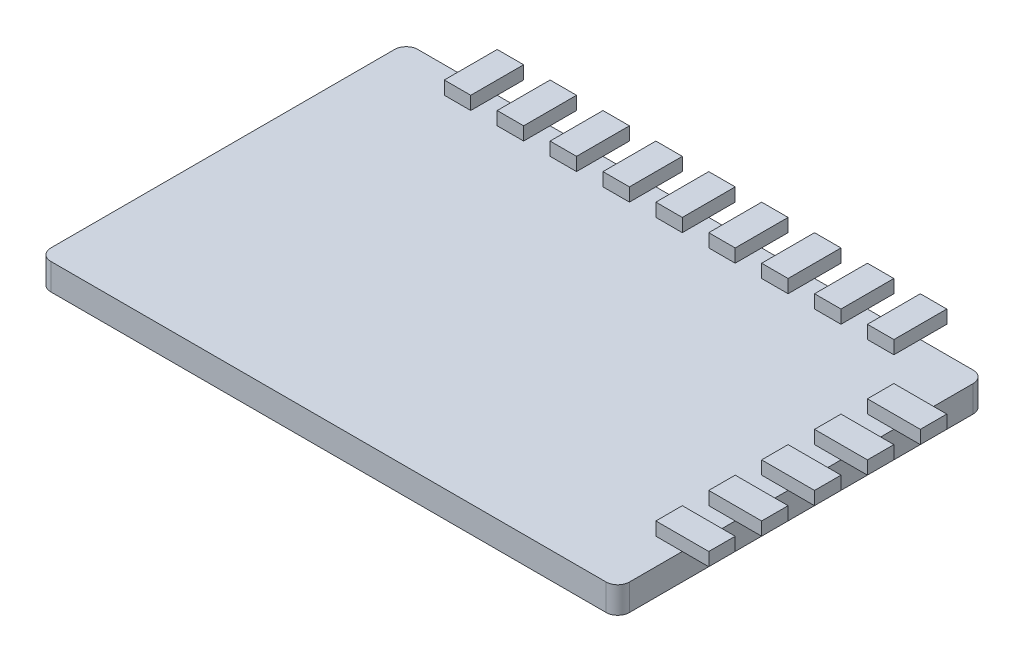
from build123d import *

# Parameters (mm, degrees)
BOSS_EXTRUDE1_DEPTH    = 6.35
SKETCH2_W              = 6.35
SKETCH2_H              = 12.7
BOSS_EXTRUDE2_DEPTH    = 3.175
BOSS_EXTRUDE2_2_DEPTH  = 3.175
BOSS_EXTRUDE2_3_DEPTH  = 3.175
BOSS_EXTRUDE2_4_DEPTH  = 3.175
BOSS_EXTRUDE2_5_DEPTH  = 3.175
BOSS_EXTRUDE2_6_DEPTH  = 3.175
BOSS_EXTRUDE2_7_DEPTH  = 3.175
BOSS_EXTRUDE2_8_DEPTH  = 3.175
BOSS_EXTRUDE2_9_DEPTH  = 3.175
SKETCH2_W_2            = 12.7
SKETCH2_H_2            = 6.35
BOSS_EXTRUDE2_10_DEPTH = 3.175
BOSS_EXTRUDE2_11_DEPTH = 3.175
BOSS_EXTRUDE2_12_DEPTH = 3.175
BOSS_EXTRUDE2_13_DEPTH = 3.175
BOSS_EXTRUDE2_14_DEPTH = 3.175


with BuildPart() as part:
    # Sketch1 → Boss-Extrude1 (new body)
    with BuildSketch(Plane(origin=(0, 0, 0), x_dir=(-1, 0, 0), z_dir=(0, 1, 0))):
        with BuildLine():
            Line((145.669, -92.075), (145.669, -9.525))
            ThreePointArc((145.669, -9.525), (144.850656347, -7.549343653), (142.875, -6.731))
            Line((142.875, -6.731), (9.525, -6.731))
            ThreePointArc((9.525, -6.731), (7.549343653, -7.549343653), (6.731, -9.525))
            Line((6.731, -9.525), (6.731, -92.075))
            ThreePointArc((6.731, -92.075), (7.549343653, -94.050656347), (9.525, -94.869))
            Line((9.525, -94.869), (142.875, -94.869))
            ThreePointArc((142.875, -94.869), (144.850656347, -94.050656347), (145.669, -92.075))
        make_face()
    extrude(amount=BOSS_EXTRUDE1_DEPTH)


with BuildPart() as body_2:
    # Sketch2 → Boss-Extrude2 (new body)
    with BuildSketch(Plane(origin=(0, 6.35, 0), x_dir=(1, 0, 0), z_dir=(0, 1, 0))):
        with Locations((-63.5, 94.869)):
            Rectangle(SKETCH2_W, SKETCH2_H)
    extrude(amount=BOSS_EXTRUDE2_DEPTH)


with BuildPart() as body_3:
    # Sketch2 → Boss-Extrude2 2 (new body)
    with BuildSketch(Plane(origin=(0, 6.35, 0), x_dir=(1, 0, 0), z_dir=(0, 1, 0))):
        with Locations((-76.2, 94.869)):
            Rectangle(SKETCH2_W, SKETCH2_H)
    extrude(amount=BOSS_EXTRUDE2_2_DEPTH)


with BuildPart() as body_4:
    # Sketch2 → Boss-Extrude2 3 (new body)
    with BuildSketch(Plane(origin=(0, 6.35, 0), x_dir=(1, 0, 0), z_dir=(0, 1, 0))):
        with Locations((-50.8, 94.869)):
            Rectangle(SKETCH2_W, SKETCH2_H)
    extrude(amount=BOSS_EXTRUDE2_3_DEPTH)


with BuildPart() as body_5:
    # Sketch2 → Boss-Extrude2 4 (new body)
    with BuildSketch(Plane(origin=(0, 6.35, 0), x_dir=(1, 0, 0), z_dir=(0, 1, 0))):
        with Locations((-38.1, 94.869)):
            Rectangle(SKETCH2_W, SKETCH2_H)
    extrude(amount=BOSS_EXTRUDE2_4_DEPTH)


with BuildPart() as body_6:
    # Sketch2 → Boss-Extrude2 5 (new body)
    with BuildSketch(Plane(origin=(0, 6.35, 0), x_dir=(1, 0, 0), z_dir=(0, 1, 0))):
        with Locations((-25.4, 94.869)):
            Rectangle(SKETCH2_W, SKETCH2_H)
    extrude(amount=BOSS_EXTRUDE2_5_DEPTH)


with BuildPart() as body_7:
    # Sketch2 → Boss-Extrude2 6 (new body)
    with BuildSketch(Plane(origin=(0, 6.35, 0), x_dir=(1, 0, 0), z_dir=(0, 1, 0))):
        with Locations((-88.9, 94.869)):
            Rectangle(SKETCH2_W, SKETCH2_H)
    extrude(amount=BOSS_EXTRUDE2_6_DEPTH)


with BuildPart() as body_8:
    # Sketch2 → Boss-Extrude2 7 (new body)
    with BuildSketch(Plane(origin=(0, 6.35, 0), x_dir=(1, 0, 0), z_dir=(0, 1, 0))):
        with Locations((-101.6, 94.869)):
            Rectangle(SKETCH2_W, SKETCH2_H)
    extrude(amount=BOSS_EXTRUDE2_7_DEPTH)


with BuildPart() as body_9:
    # Sketch2 → Boss-Extrude2 8 (new body)
    with BuildSketch(Plane(origin=(0, 6.35, 0), x_dir=(1, 0, 0), z_dir=(0, 1, 0))):
        with Locations((-114.3, 94.869)):
            Rectangle(SKETCH2_W, SKETCH2_H)
    extrude(amount=BOSS_EXTRUDE2_8_DEPTH)


with BuildPart() as body_10:
    # Sketch2 → Boss-Extrude2 9 (new body)
    with BuildSketch(Plane(origin=(0, 6.35, 0), x_dir=(1, 0, 0), z_dir=(0, 1, 0))):
        with Locations((-127, 94.869)):
            Rectangle(SKETCH2_W, SKETCH2_H)
    extrude(amount=BOSS_EXTRUDE2_9_DEPTH)


with BuildPart() as body_11:
    # Sketch2 → Boss-Extrude2 10 (new body)
    with BuildSketch(Plane(origin=(0, 6.35, 0), x_dir=(1, 0, 0), z_dir=(0, 1, 0))):
        with Locations((-6.731, 50.8)):
            Rectangle(SKETCH2_W_2, SKETCH2_H_2)
    extrude(amount=BOSS_EXTRUDE2_10_DEPTH)


with BuildPart() as body_12:
    # Sketch2 → Boss-Extrude2 11 (new body)
    with BuildSketch(Plane(origin=(0, 6.35, 0), x_dir=(1, 0, 0), z_dir=(0, 1, 0))):
        with Locations((-6.731, 63.5)):
            Rectangle(SKETCH2_W_2, SKETCH2_H_2)
    extrude(amount=BOSS_EXTRUDE2_11_DEPTH)


with BuildPart() as body_13:
    # Sketch2 → Boss-Extrude2 12 (new body)
    with BuildSketch(Plane(origin=(0, 6.35, 0), x_dir=(1, 0, 0), z_dir=(0, 1, 0))):
        with Locations((-6.731, 76.2)):
            Rectangle(SKETCH2_W_2, SKETCH2_H_2)
    extrude(amount=BOSS_EXTRUDE2_12_DEPTH)


with BuildPart() as body_14:
    # Sketch2 → Boss-Extrude2 13 (new body)
    with BuildSketch(Plane(origin=(0, 6.35, 0), x_dir=(1, 0, 0), z_dir=(0, 1, 0))):
        with Locations((-6.731, 38.1)):
            Rectangle(SKETCH2_W_2, SKETCH2_H_2)
    extrude(amount=BOSS_EXTRUDE2_13_DEPTH)


with BuildPart() as body_15:
    # Sketch2 → Boss-Extrude2 14 (new body)
    with BuildSketch(Plane(origin=(0, 6.35, 0), x_dir=(1, 0, 0), z_dir=(0, 1, 0))):
        with Locations((-6.731, 25.4)):
            Rectangle(SKETCH2_W_2, SKETCH2_H_2)
    extrude(amount=BOSS_EXTRUDE2_14_DEPTH)


solid = Compound([part.part, body_2.part, body_3.part, body_4.part, body_5.part, body_6.part, body_7.part, body_8.part, body_9.part, body_10.part, body_11.part, body_12.part, body_13.part, body_14.part, body_15.part])
